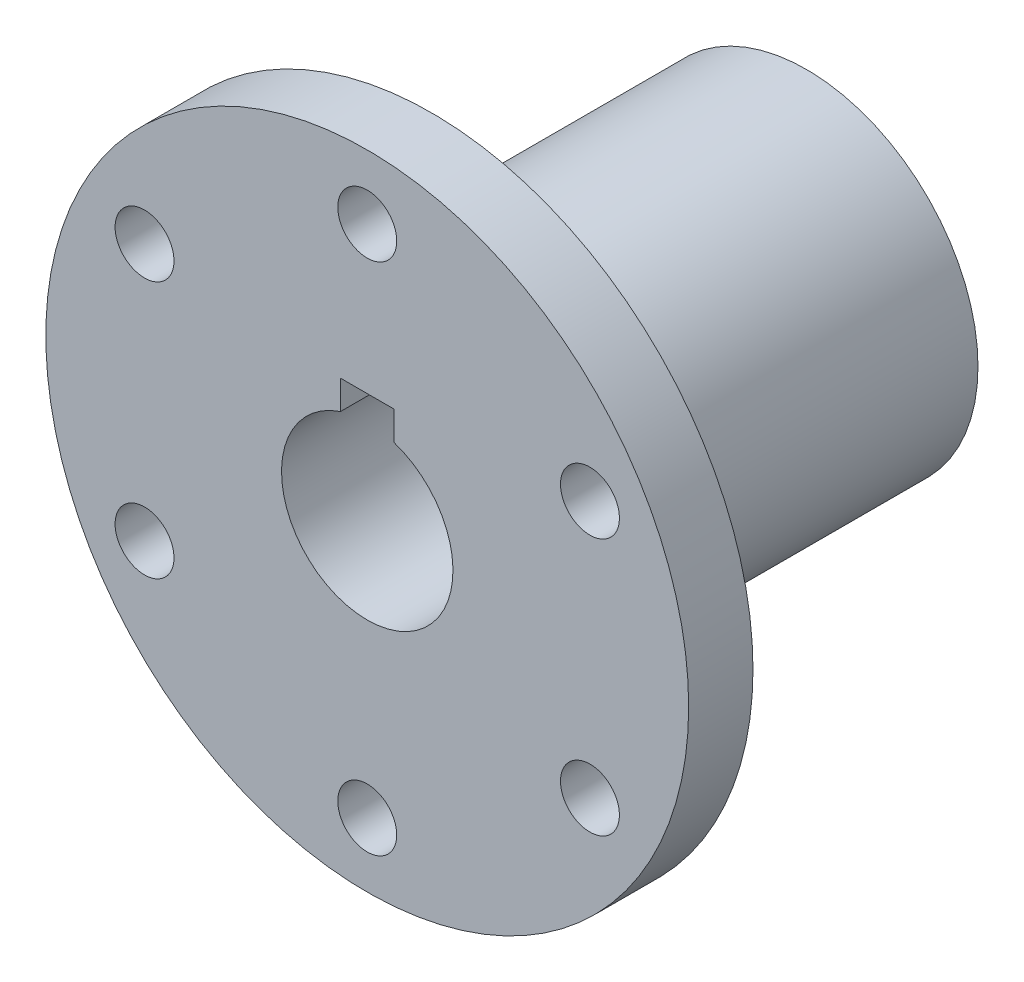
from build123d import *

# Parameters (mm, degrees)
CUT_EXTRUDE_1_REACH = 57
SKETCH_2_R          = 2.75
FILLET_1_R          = 2
SKETCH1_R           = 8
CUT_EXTRUDE1_DEPTH  = 60
CUT_EXTRUDE2_DEPTH  = 60


with BuildPart() as part:
    # 草图1 → 旋转1 (revolve)
    with BuildSketch(Plane(origin=(0, 0, 0), x_dir=(0, 0, -1), z_dir=(1, 0, 0)), mode=Mode.PRIVATE) as revolve_1_sk:
        Polygon((0, 0), (0, 30), (6, 30), (6, 16), (41, 16), (41, 0), align=None)
    revolve(revolve_1_sk.sketch.rotate(Axis((0, 0, 0), (0, 0, -1)), 90), axis=Axis((0, 0, 0), (0, 0, -1)))

    # 草图2 → 切除-拉伸1 (cut, up to next)
    with BuildSketch(Plane(origin=(0, 0, -6), x_dir=(-1, 0, 0), z_dir=(0, 0, -1)), mode=Mode.PRIVATE) as cut_extrude_1_sk1:
        with Locations((0, 24)):
            Circle(SKETCH_2_R)
    cut_extrude_1_tool1 = extrude(cut_extrude_1_sk1.sketch, amount=-CUT_EXTRUDE_1_REACH, mode=Mode.PRIVATE) & part.part
    # 草图2 → 切除-拉伸1 (cut, up to next)
    with BuildSketch(Plane(origin=(0, 0, -6), x_dir=(-1, 0, 0), z_dir=(0, 0, -1)), mode=Mode.PRIVATE) as cut_extrude_1_sk2:
        with Locations((20.784609691, 12)):
            Circle(SKETCH_2_R)
    cut_extrude_1_tool2 = extrude(cut_extrude_1_sk2.sketch, amount=-CUT_EXTRUDE_1_REACH, mode=Mode.PRIVATE) & part.part
    # 草图2 → 切除-拉伸1 (cut, up to next)
    with BuildSketch(Plane(origin=(0, 0, -6), x_dir=(-1, 0, 0), z_dir=(0, 0, -1)), mode=Mode.PRIVATE) as cut_extrude_1_sk3:
        with Locations((20.784609691, -12)):
            Circle(SKETCH_2_R)
    cut_extrude_1_tool3 = extrude(cut_extrude_1_sk3.sketch, amount=-CUT_EXTRUDE_1_REACH, mode=Mode.PRIVATE) & part.part
    # 草图2 → 切除-拉伸1 (cut, up to next)
    with BuildSketch(Plane(origin=(0, 0, -6), x_dir=(-1, 0, 0), z_dir=(0, 0, -1)), mode=Mode.PRIVATE) as cut_extrude_1_sk4:
        with Locations((0, -24)):
            Circle(SKETCH_2_R)
    cut_extrude_1_tool4 = extrude(cut_extrude_1_sk4.sketch, amount=-CUT_EXTRUDE_1_REACH, mode=Mode.PRIVATE) & part.part
    # 草图2 → 切除-拉伸1 (cut, up to next)
    with BuildSketch(Plane(origin=(0, 0, -6), x_dir=(-1, 0, 0), z_dir=(0, 0, -1)), mode=Mode.PRIVATE) as cut_extrude_1_sk5:
        with Locations((-20.784609691, -12)):
            Circle(SKETCH_2_R)
    cut_extrude_1_tool5 = extrude(cut_extrude_1_sk5.sketch, amount=-CUT_EXTRUDE_1_REACH, mode=Mode.PRIVATE) & part.part
    # 草图2 → 切除-拉伸1 (cut, up to next)
    with BuildSketch(Plane(origin=(0, 0, -6), x_dir=(-1, 0, 0), z_dir=(0, 0, -1)), mode=Mode.PRIVATE) as cut_extrude_1_sk6:
        with Locations((-20.784609691, 12)):
            Circle(SKETCH_2_R)
    cut_extrude_1_tool6 = extrude(cut_extrude_1_sk6.sketch, amount=-CUT_EXTRUDE_1_REACH, mode=Mode.PRIVATE) & part.part
    add(cut_extrude_1_tool1.solids().sort_by_distance((0, 24, -6))[0], mode=Mode.SUBTRACT)
    add(cut_extrude_1_tool2.solids().sort_by_distance((-20.78461, 12, -6))[0], mode=Mode.SUBTRACT)
    add(cut_extrude_1_tool3.solids().sort_by_distance((-20.78461, -12, -6))[0], mode=Mode.SUBTRACT)
    add(cut_extrude_1_tool4.solids().sort_by_distance((0, -24, -6))[0], mode=Mode.SUBTRACT)
    add(cut_extrude_1_tool5.solids().sort_by_distance((20.78461, -12, -6))[0], mode=Mode.SUBTRACT)
    add(cut_extrude_1_tool6.solids().sort_by_distance((20.78461, 12, -6))[0], mode=Mode.SUBTRACT)

    # 圆角1
    fillet_1_edges = [part.edges().sort_by_distance(p)[0] for p in [
        (-16, 0, -6),
    ]]
    fillet(fillet_1_edges, radius=FILLET_1_R)

    # Sketch1 → Cut-Extrude1 (cut, through all)
    with BuildSketch(Plane(origin=(0, 0, -41), x_dir=(-1, 0, 0), z_dir=(0, 0, -1))):
        Circle(SKETCH1_R)
    extrude(amount=-CUT_EXTRUDE1_DEPTH, mode=Mode.SUBTRACT)

    # Sketch2 → Cut-Extrude2 (cut, through all)
    with BuildSketch(Plane(origin=(0, 0, -41), x_dir=(-1, 0, 0), z_dir=(0, 0, -1))):
        with BuildLine():
            Line((-2.5, 7.599342077), (-2.5, 10.3))
            Line((-2.5, 10.3), (2.5, 10.3))
            Line((2.5, 10.3), (2.5, 7.599342077))
            ThreePointArc((2.5, 7.599342077), (0, 8), (-2.5, 7.599342077))
        make_face()
    extrude(amount=-CUT_EXTRUDE2_DEPTH, mode=Mode.SUBTRACT)


solid = part.part
